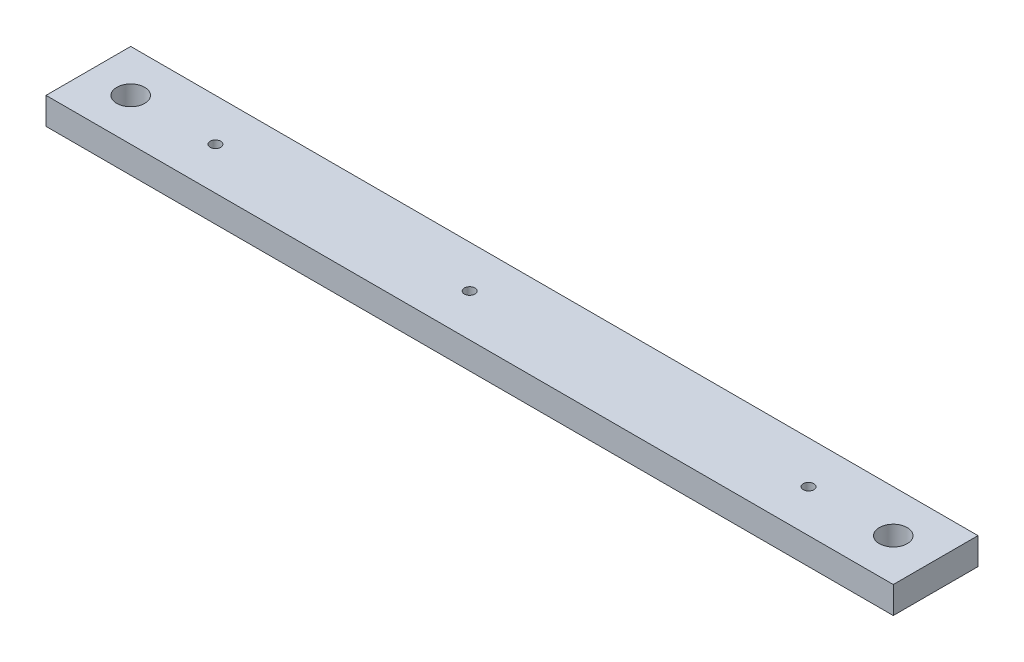
from build123d import *

# Parameters (mm, degrees)
SKETCH1_W             = 200
SKETCH1_H             = 20
BOSS_EXTRUDE1_DEPTH   = 6.35
M3X0_5_TAPPED_HOLE1_D = 2.5
M6_CLEARANCE_HOLE1_D  = 6.6


with BuildPart() as part:
    # Sketch1 → Boss-Extrude1 (new body)
    with BuildSketch(Plane(origin=(0, 0, 0), x_dir=(1, 0, 0), z_dir=(0, 1, 0))):
        with Locations((100, 10)):
            Rectangle(SKETCH1_W, SKETCH1_H)
    extrude(amount=BOSS_EXTRUDE1_DEPTH)

    # M3x0.5 Tapped Hole1 (through all)
    with Locations(Plane(origin=(0, 6.35, 0), x_dir=(1, 0, 0), z_dir=(0, 1, 0))):
        with Locations((30, 10), (170, 10), (90, 10)):
            Hole(M3X0_5_TAPPED_HOLE1_D / 2)

    # M6 Clearance Hole1 (through all)
    with Locations(Plane(origin=(0, 6.35, 0), x_dir=(1, 0, 0), z_dir=(0, 1, 0))):
        with Locations((10, 10), (190, 10)):
            Hole(M6_CLEARANCE_HOLE1_D / 2)


solid = part.part
